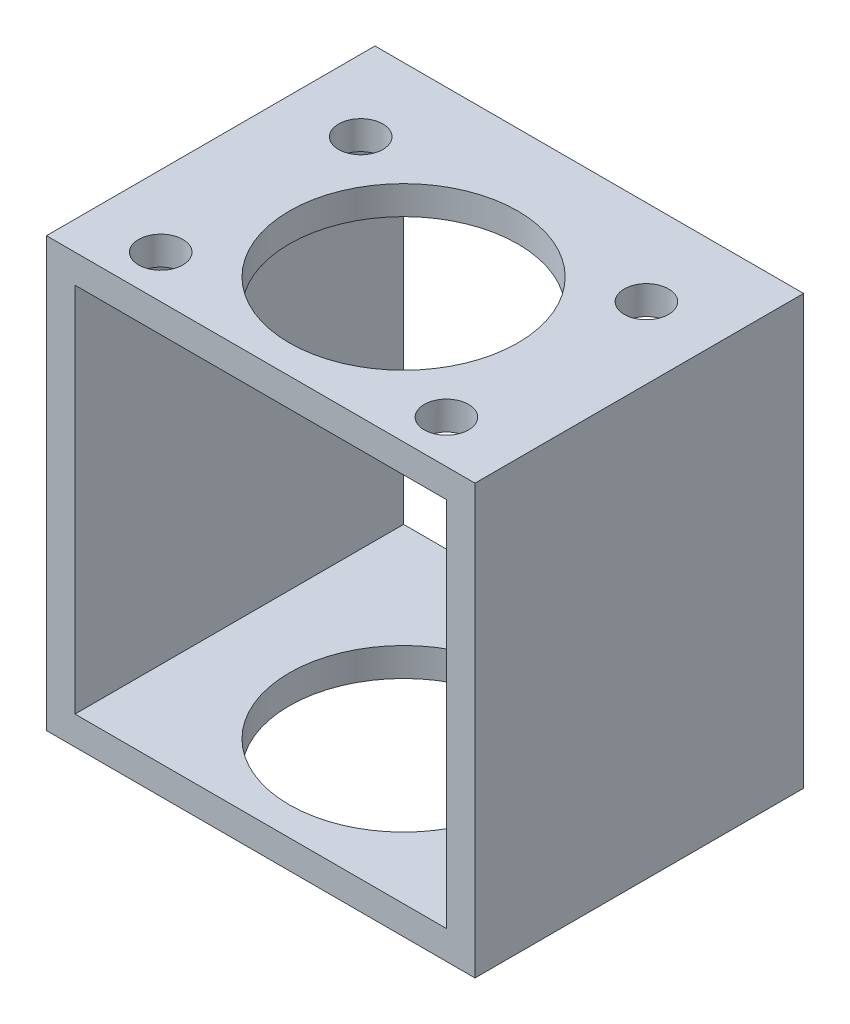
from build123d import *

# Parameters (mm, degrees)
SKETCH1_W               = 30
SKETCH1_H               = 30
SKETCH1_W_2             = 26
SKETCH1_H_2             = 26
BOSS_EXTRUDE1_DEPTH     = 23
CUT_EXTRUDE1_DEPTH      = 30
CUT_EXTRUDE1_DEPTH_BACK = 3
SKETCH2_R               = 8
SKETCH4_R               = 1.55
CUT_EXTRUDE2_DEPTH      = 3


with BuildPart() as part:
    # Sketch1 → Boss-Extrude1 (new body)
    with BuildSketch(Plane.XY):
        Rectangle(SKETCH1_W, SKETCH1_H)
        Rectangle(SKETCH1_W_2, SKETCH1_H_2, mode=Mode.SUBTRACT)
    extrude(amount=BOSS_EXTRUDE1_DEPTH)

    # Sketch2 → Cut-Extrude1 (cut, two sides: drawn at the far end of the back side and taken through both)
    with BuildSketch(Plane(origin=(0, -13, 0), x_dir=(1, 0, 0), z_dir=(0, 1, 0)).offset(-CUT_EXTRUDE1_DEPTH_BACK)):
        with Locations(Location((0, -13, 0), (0, 0, 270))):
            Circle(SKETCH2_R)
    extrude(amount=CUT_EXTRUDE1_DEPTH + CUT_EXTRUDE1_DEPTH_BACK, mode=Mode.SUBTRACT)

    # Sketch4 → Cut-Extrude2 (cut)
    with BuildSketch(Plane(origin=(0, 15, 0), x_dir=(1, 0, 0), z_dir=(0, 1, 0))):
        with Locations(Location((-10, -6, 0), (0, 0, 270))):
            Circle(SKETCH4_R)
        with Locations(Location((10, -6, 0), (0, 0, 270))):
            Circle(SKETCH4_R)
        with Locations(Location((10, -20, 0), (0, 0, 270))):
            Circle(SKETCH4_R)
        with Locations(Location((-10, -20, 0), (0, 0, 270))):
            Circle(SKETCH4_R)
    extrude(amount=-CUT_EXTRUDE2_DEPTH, mode=Mode.SUBTRACT)


solid = part.part
